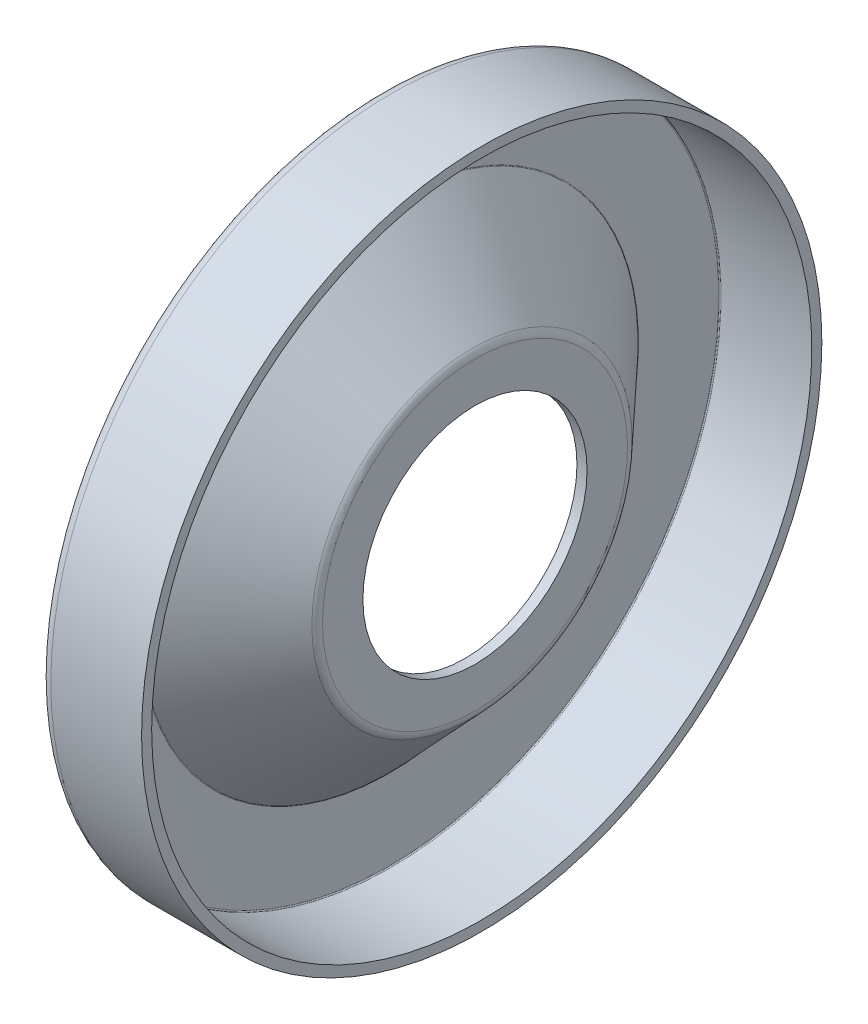
from build123d import *


with BuildPart() as part:
    # Croquis1 → Revolución1 (revolve)
    with BuildSketch(Plane.XY, mode=Mode.PRIVATE) as revoluci_n1_sk:
        with BuildLine():
            Line((0.9, -10), (0.9, -13.606089524))
            ThreePointArc((0.9, -13.606089524), (0.830417568, -13.972590751), (0.631353702, -14.288087884))
            Line((0.631353702, -14.288087884), (-6.67313537, -22.121193408))
            ThreePointArc((-6.67313537, -22.121193408), (-6.693041757, -22.152743121), (-6.7, -22.189393244))
            Line((-6.7, -22.189393244), (-6.7, -29.35))
            ThreePointArc((-6.7, -29.35), (-6.670710678, -29.420710678), (-6.6, -29.45))
            Line((-6.6, -29.45), (1.5, -29.45))
            Line((1.5, -29.45), (1.5, -30.35))
            Line((1.5, -30.35), (-6.6, -30.35))
            ThreePointArc((-6.6, -30.35), (-7.307106781, -30.057106781), (-7.6, -29.35))
            Line((-7.6, -29.35), (-7.6, -22.189393244))
            ThreePointArc((-7.6, -22.189393244), (-7.530417568, -21.822892017), (-7.331353702, -21.507394884))
            Line((-7.331353702, -21.507394884), (-0.02686463, -13.67428936))
            ThreePointArc((-0.02686463, -13.67428936), (-0.006958243, -13.642739647), (0, -13.606089524))
            Line((0, -13.606089524), (0, -10))
            Line((0, -10), (0.9, -10))
        make_face()
    revolve(revoluci_n1_sk.sketch.rotate(Axis((0, 0, 0), (1, 0, 0)), 270), axis=Axis((0, 0, 0), (1, 0, 0)))


solid = part.part
